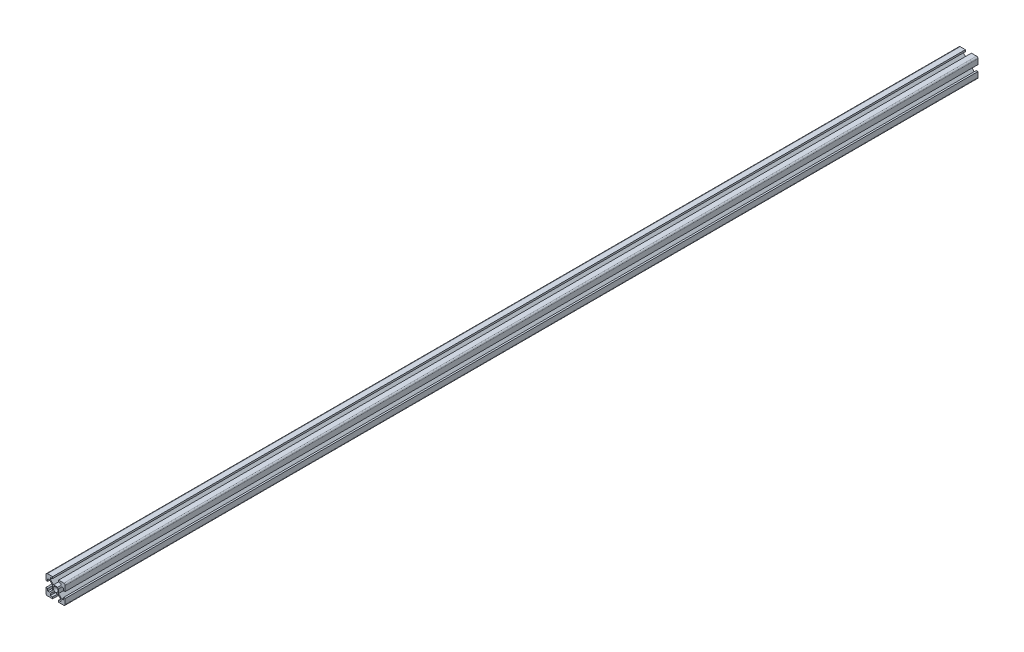
from build123d import *

# Parameters (mm, degrees)
SKETCH_1_R      = 2.5
EXTRUDE_1_DEPTH = 950


with BuildPart() as part:
    # 草图1 → 凸台-拉伸1 (new body)
    with BuildSketch(Plane.XY):
        with BuildLine():
            Line((-8.2, -3.1), (-10, -3.1))
            Line((-10, -3.1), (-10, -8.5))
            ThreePointArc((-10, -8.5), (-9.560660172, -9.560660172), (-8.5, -10))
            Line((-8.5, -10), (-3.1, -10))
            Line((-3.1, -10), (-3.1, -8.2))
            Line((-3.1, -8.2), (-5.5, -8.2))
            Line((-5.5, -8.2), (-5.5, -6.397050155))
            Line((-5.5, -6.397050155), (-2.202949845, -3.1))
            Line((-2.202949845, -3.1), (2.202949845, -3.1))
            Line((2.202949845, -3.1), (5.5, -6.397050155))
            Line((5.5, -6.397050155), (5.5, -8.2))
            Line((5.5, -8.2), (3.1, -8.2))
            Line((3.1, -8.2), (3.1, -10))
            Line((3.1, -10), (8.5, -10))
            ThreePointArc((8.5, -10), (9.560660172, -9.560660172), (10, -8.5))
            Line((10, -8.5), (10, -3.1))
            Line((10, -3.1), (8.2, -3.1))
            Line((8.2, -3.1), (8.2, -5.5))
            Line((8.2, -5.5), (6.397050155, -5.5))
            Line((6.397050155, -5.5), (3.05412702, -2.157076865))
            Line((3.05412702, -2.157076865), (3.05412702, 2.157076865))
            Line((3.05412702, 2.157076865), (6.397050155, 5.5))
            Line((6.397050155, 5.5), (8.2, 5.5))
            Line((8.2, 5.5), (8.2, 3.1))
            Line((8.2, 3.1), (10, 3.1))
            Line((10, 3.1), (10, 8.5))
            ThreePointArc((10, 8.5), (9.560660172, 9.560660172), (8.5, 10))
            Line((8.5, 10), (3.1, 10))
            Line((3.1, 10), (3.1, 8.2))
            Line((3.1, 8.2), (5.5, 8.2))
            Line((5.5, 8.2), (5.5, 6.397050155))
            Line((5.5, 6.397050155), (2.202949845, 3.1))
            Line((2.202949845, 3.1), (-2.202949845, 3.1))
            Line((-2.202949845, 3.1), (-5.5, 6.397050155))
            Line((-5.5, 6.397050155), (-5.5, 8.2))
            Line((-5.5, 8.2), (-3.1, 8.2))
            Line((-3.1, 8.2), (-3.1, 10))
            Line((-3.1, 10), (-8.5, 10))
            ThreePointArc((-8.5, 10), (-9.560660172, 9.560660172), (-10, 8.5))
            Line((-10, 8.5), (-10, 3.1))
            Line((-10, 3.1), (-8.2, 3.1))
            Line((-8.2, 3.1), (-8.2, 5.5))
            Line((-8.2, 5.5), (-6.397050155, 5.5))
            Line((-6.397050155, 5.5), (-3.05412702, 2.157076865))
            Line((-3.05412702, 2.157076865), (-3.05412702, -2.157076865))
            Line((-3.05412702, -2.157076865), (-6.397050155, -5.5))
            Line((-6.397050155, -5.5), (-8.2, -5.5))
            Line((-8.2, -5.5), (-8.2, -3.1))
        make_face()
        with Locations(Location((0, 0, 0), (0, 0, 180))):
            Circle(SKETCH_1_R, mode=Mode.SUBTRACT)
    extrude(amount=EXTRUDE_1_DEPTH)


solid = part.part
